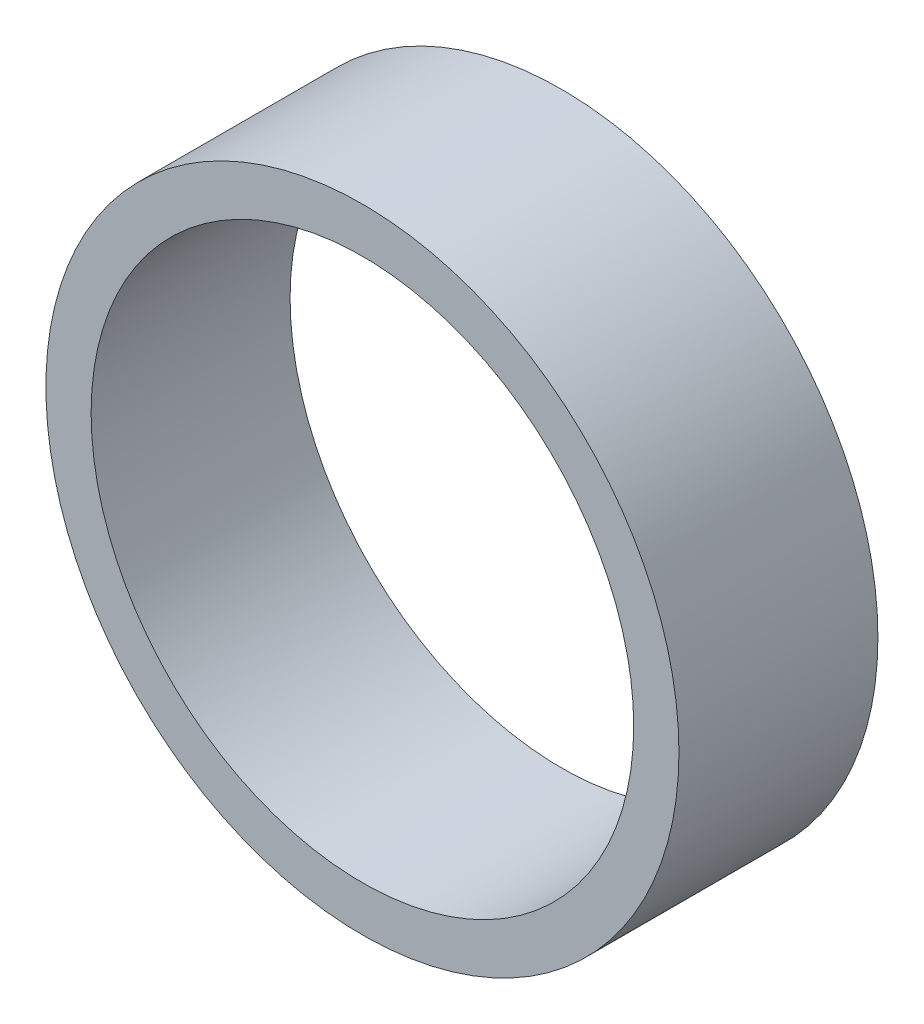
from build123d import *

# Parameters (mm, degrees)
SKETCH1_R           = 3.5
SKETCH1_R_2         = 3
BOSS_EXTRUDE1_DEPTH = 2.2
SCALE1_SCALE        = 1.5


with BuildPart() as part:
    # Sketch1 → Boss-Extrude1 (new body)
    with BuildSketch(Plane.XY):
        Circle(SKETCH1_R)
        Circle(SKETCH1_R_2, mode=Mode.SUBTRACT)
    extrude(amount=-BOSS_EXTRUDE1_DEPTH)


with BuildPart() as part_1:
    # Scale1: scaled about (0, 0, 0)
    add(part.part.scale(SCALE1_SCALE))


solid = part_1.part
